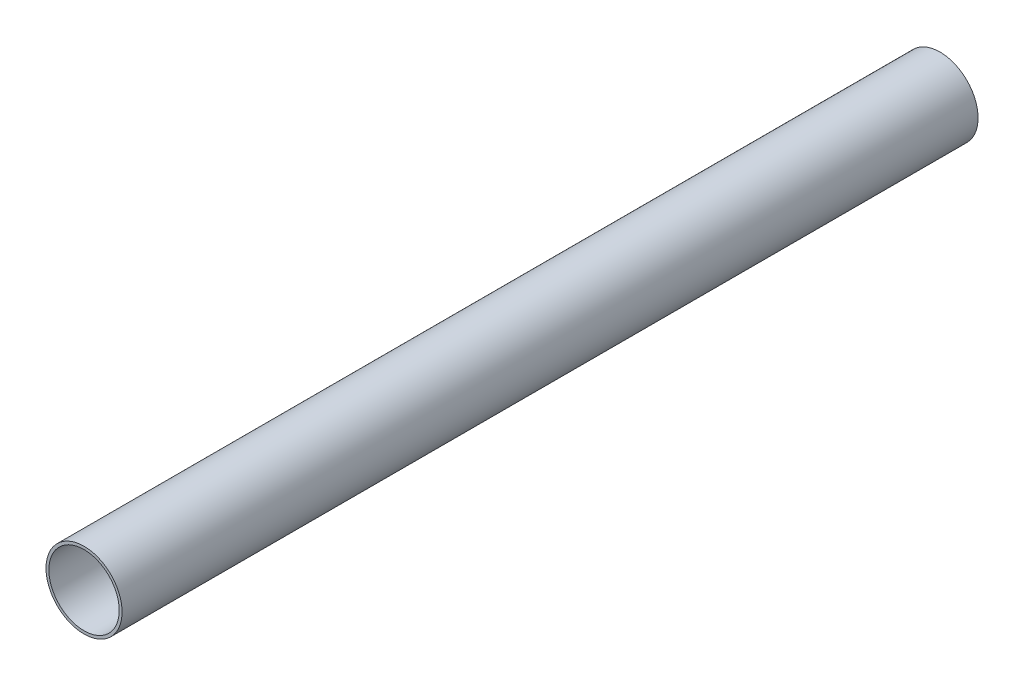
from build123d import *

# Parameters (mm, degrees)
SKETCH1_R           = 8
SKETCH1_R_2         = 7.4
BOSS_EXTRUDE1_DEPTH = 180


with BuildPart() as part:
    # Sketch1 → Boss-Extrude1 (new body)
    with BuildSketch(Plane.XY):
        with Locations(Location((0, 0, 0), (0, 0, 180))):
            Circle(SKETCH1_R)
        with Locations(Location((0, 0, 0), (0, 0, 180))):
            Circle(SKETCH1_R_2, mode=Mode.SUBTRACT)
    extrude(amount=BOSS_EXTRUDE1_DEPTH)


solid = part.part
